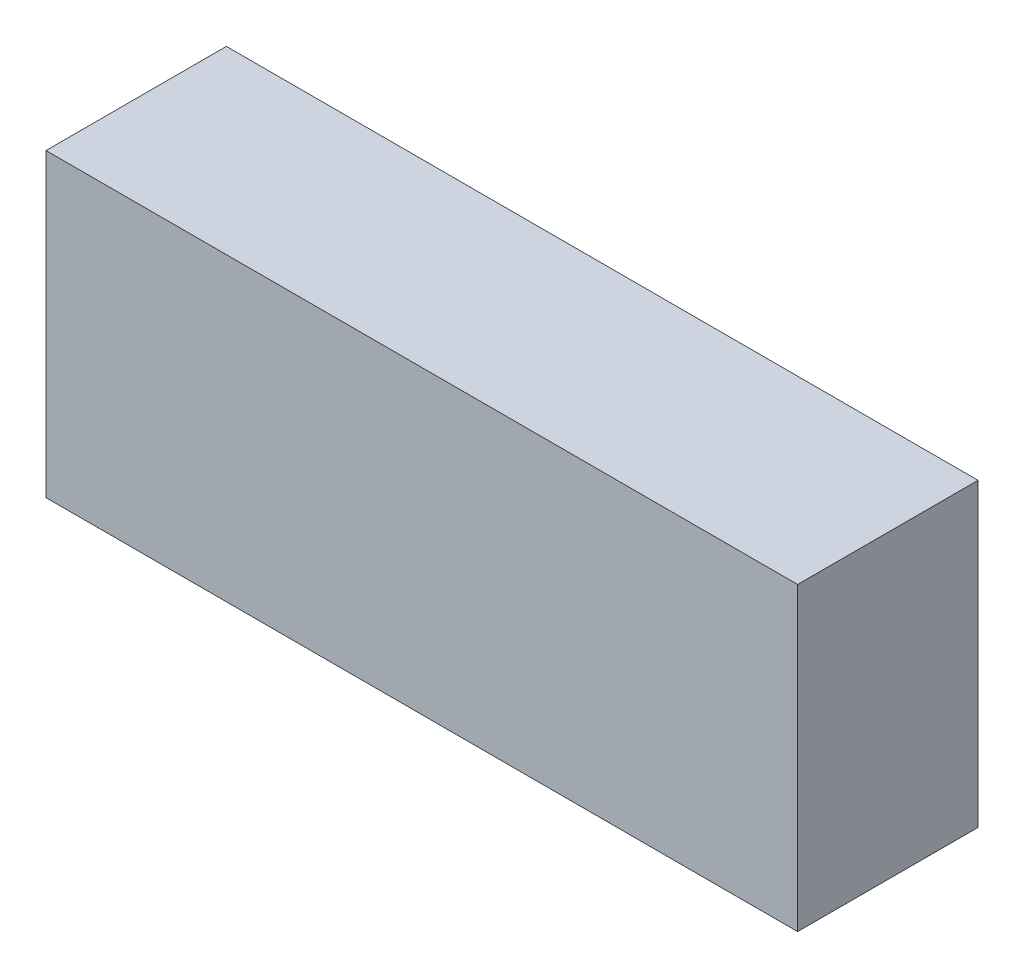
from build123d import *

# Parameters (mm, degrees)
SKETCH_1_W      = 25
SKETCH_1_H      = 10
EXTRUDE_1_DEPTH = 6


with BuildPart() as part:
    # 스케치1 → 보스-돌출1 (new body)
    with BuildSketch(Plane.XY):
        Rectangle(SKETCH_1_W, SKETCH_1_H)
    extrude(amount=EXTRUDE_1_DEPTH)


solid = part.part
